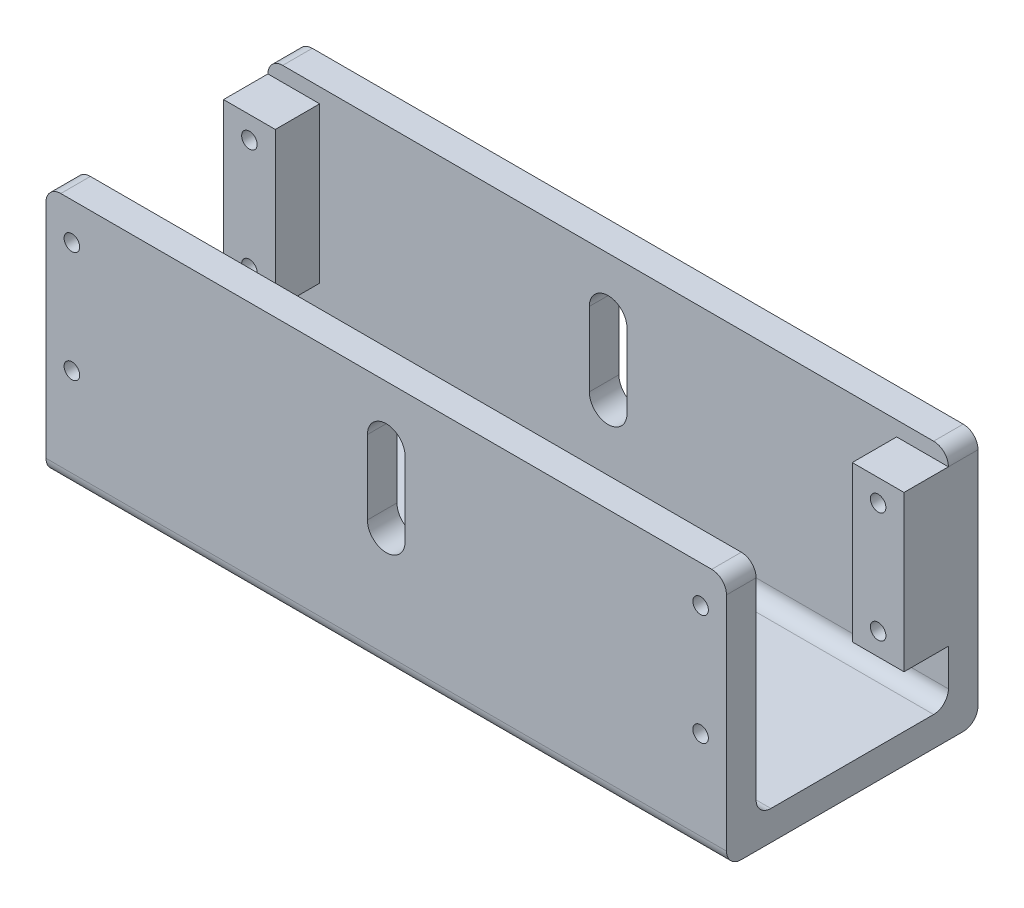
from build123d import *

# Parameters (mm, degrees)
SKETCH_1_W          = 92
SKETCH_1_H          = 30
SKETCH_1_R          = 1.05
EXTRUDE_1_DEPTH     = 4
SKETCH_4_W          = 92
SKETCH_4_H          = 30
EXTRUDE_4_DEPTH     = 4
SKETCH_5_W          = 92
SKETCH_5_H          = 34
SKETCH_5_R          = 1.05
EXTRUDE_5_DEPTH     = 4
FILLET_4_R          = 2
CUT_EXTRUDE_1_DEPTH = 45
SKETCH_8_R          = 2.55
CUT_EXTRUDE_2_DEPTH = 5
SKETCH_9_W          = 7
SKETCH_9_H          = 21
SKETCH_9_R          = 1.05
EXTRUDE_6_DEPTH     = 6


with BuildPart() as part:
    # 草图1 → 凸台-拉伸1 (new body)
    with BuildSketch(Plane.XY):
        with Locations((46, -15)):
            Rectangle(SKETCH_1_W, SKETCH_1_H)
        with Locations((3.5, -5)):
            Circle(SKETCH_1_R, mode=Mode.SUBTRACT)
        with Locations((3.5, -20)):
            Circle(SKETCH_1_R, mode=Mode.SUBTRACT)
        with Locations((88.5, -5)):
            Circle(SKETCH_1_R, mode=Mode.SUBTRACT)
        with Locations((88.5, -20)):
            Circle(SKETCH_1_R, mode=Mode.SUBTRACT)
        with BuildLine():
            Line((43.45, -17.5), (43.45, -7.5))
            ThreePointArc((43.45, -7.5), (46, -4.95), (48.55, -7.5))
            Line((48.55, -7.5), (48.55, -17.5))
            ThreePointArc((48.55, -17.5), (46, -20.05), (43.45, -17.5))
        make_face(mode=Mode.SUBTRACT)
    extrude(amount=EXTRUDE_1_DEPTH)

    # 草图4 → 凸台-拉伸4 (add)
    with BuildSketch(Plane(origin=(0, -30, 0), x_dir=(-1, 0, 0), z_dir=(0, -1, 0))):
        with Locations((-46, -15)):
            Rectangle(SKETCH_4_W, SKETCH_4_H)
    extrude(amount=EXTRUDE_4_DEPTH)

    # 草图5 → 凸台-拉伸5 (add)
    with BuildSketch(Plane.XY.offset(30)):
        with Locations((46, -17)):
            Rectangle(SKETCH_5_W, SKETCH_5_H)
        with Locations((3.5, -5)):
            Circle(SKETCH_5_R, mode=Mode.SUBTRACT)
        with Locations((3.5, -20)):
            Circle(SKETCH_5_R, mode=Mode.SUBTRACT)
        with Locations((88.5, -20)):
            Circle(SKETCH_5_R, mode=Mode.SUBTRACT)
        with Locations((88.5, -5)):
            Circle(SKETCH_5_R, mode=Mode.SUBTRACT)
    extrude(amount=EXTRUDE_5_DEPTH)

    # 圆角4
    fillet_4_edges = [part.edges().sort_by_distance(p)[0] for p in [
        (46, -30, 30),
        (46, -34, 0),
        (46, -34, 34),
        (0, 0, 32),
        (92, 0, 32),
        (0, 0, 2),
        (92, 0, 2),
        (46, -30, 4),
    ]]
    fillet(fillet_4_edges, radius=FILLET_4_R)

    # 草图7 → 切除-拉伸1 (cut)
    with BuildSketch(Plane(origin=(0, 0, 0), x_dir=(-1, 0, 0), z_dir=(0, 0, -1))):
        with BuildLine():
            Line((-48.55, -17.5), (-48.55, -7.5))
            ThreePointArc((-48.55, -7.5), (-46, -4.95), (-43.45, -7.5))
            Line((-43.45, -7.5), (-43.45, -17.5))
            ThreePointArc((-43.45, -17.5), (-46, -20.05), (-48.55, -17.5))
        make_face()
    extrude(amount=-CUT_EXTRUDE_1_DEPTH, mode=Mode.SUBTRACT)

    # 草图8 → 切除-拉伸2 (cut)
    with BuildSketch(Plane(origin=(0, -34, 0), x_dir=(-1, 0, 0), z_dir=(0, -1, 0))):
        with Locations(Location((-46, -16.5, 0), (0, 0, 90))):
            Circle(SKETCH_8_R)
    extrude(amount=-CUT_EXTRUDE_2_DEPTH, mode=Mode.SUBTRACT)

    # 草图9 → 凸台-拉伸6 (add)
    # profile 1 of 2: a face of its own
    with BuildSketch(Plane.XY.offset(4)):
        with Locations((88.5, -12.5)):
            Rectangle(SKETCH_9_W, SKETCH_9_H)
        with Locations((88.5, -5)):
            Circle(SKETCH_9_R, mode=Mode.SUBTRACT)
        with Locations((88.5, -20)):
            Circle(SKETCH_9_R, mode=Mode.SUBTRACT)
    # profile 2 of 2: a face of its own
    with BuildSketch(Plane.XY.offset(4)):
        with Locations((3.5, -12.5)):
            Rectangle(SKETCH_9_W, SKETCH_9_H)
        with Locations((3.5, -5)):
            Circle(SKETCH_9_R, mode=Mode.SUBTRACT)
        with Locations((3.5, -20)):
            Circle(SKETCH_9_R, mode=Mode.SUBTRACT)
    extrude(amount=EXTRUDE_6_DEPTH)


solid = part.part
